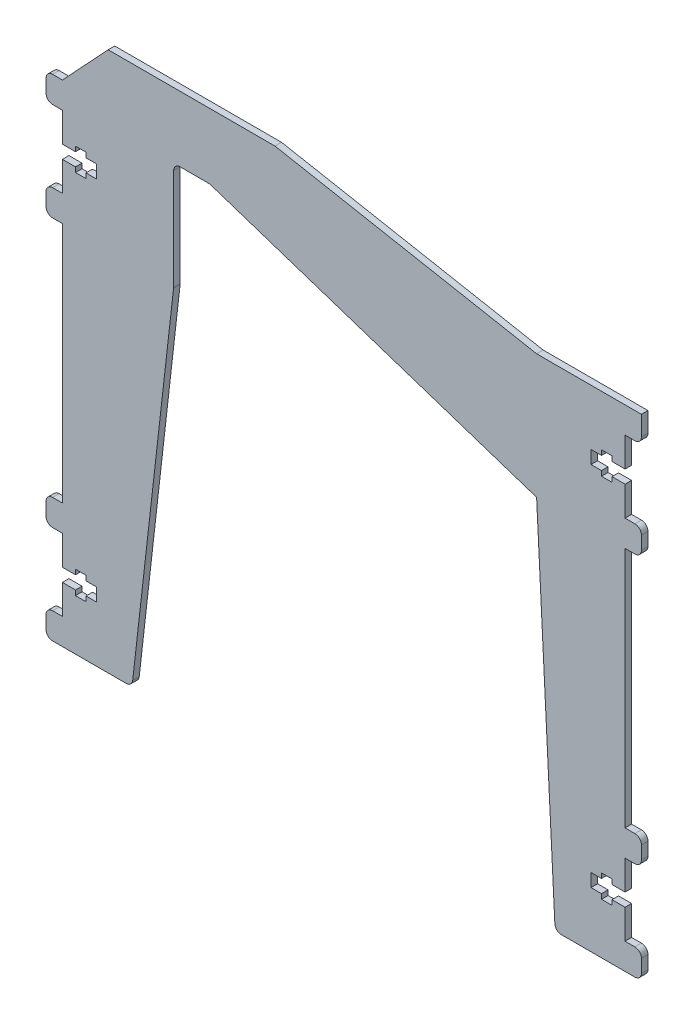
from build123d import *

# Parameters (mm, degrees)
EXTRUDE_1_DEPTH = 2
FILLET_1_R      = 2


with BuildPart() as part:
    # 草图1 → 凸台-拉伸1 (new body)
    with BuildSketch(Plane.XY):
        Polygon((81.606020908, 1.417469639), (81.606020908, 9.417469639), (76.606020908, 9.417469639), (76.606020908, 18.417469797), (72.606020908, 18.417469797), (72.606020908, 16.917469797), (69.406020908, 16.917469797), (69.406020908, 18.417469797), (66.206020908, 18.417469797), (66.206020908, 22.417469797), (69.406020908, 22.417469797), (69.406020908, 23.917469797), (72.606020908, 23.917469797), (72.606020908, 22.417469797), (76.606020908, 22.417469797), (76.606020908, 31.417469956), (81.606020908, 31.417469956), (81.606020908, 39.417469956), (76.606020908, 39.417469956), (49.568659109, 39.417469956), (-30.393979092, 54.417469639), (-81.393979092, 54.417469639), (-95.393979092, 39.417469956), (-100.393979092, 39.417469956), (-100.393979092, 31.417469956), (-95.393979092, 31.417469956), (-95.393979092, 22.417469797), (-91.393979092, 22.417469797), (-91.393979092, 23.917469797), (-88.193979092, 23.917469797), (-88.193979092, 22.417469797), (-84.993979092, 22.417469797), (-84.993979092, 18.417469797), (-88.193979092, 18.417469797), (-88.193979092, 16.917469797), (-91.393979092, 16.917469797), (-91.393979092, 18.417469797), (-95.393979092, 18.417469797), (-95.393979092, 9.417469639), (-100.393979092, 9.417469639), (-100.393979092, 1.417469639), (-95.393979092, 1.417469639), (-95.393979092, -72.582530044), (-100.393979092, -72.582530044), (-100.393979092, -80.582530044), (-95.393979092, -80.582530044), (-95.393979092, -89.582530203), (-91.393979092, -89.582530203), (-91.393979092, -88.082530203), (-88.193979092, -88.082530203), (-88.193979092, -89.582530203), (-84.993979092, -89.582530203), (-84.993979092, -93.582530203), (-88.193979092, -93.582530203), (-88.193979092, -95.082530203), (-91.393979092, -95.082530203), (-91.393979092, -93.582530203), (-95.393979092, -93.582530203), (-95.393979092, -102.582530361), (-100.393979092, -102.582530361), (-100.393979092, -110.582530361), (-95.393979092, -110.582530361), (-74.110124615, -110.582530361), (-61.393979092, 1.417469639), (-61.393979092, 34.417469639), (-50.393979092, 34.417469639), (49.568659109, 1.417469639), (55.241335591, -110.582530361), (76.606020908, -110.582530361), (81.606020908, -110.582530361), (81.606020908, -102.582530361), (76.606020908, -102.582530361), (76.606020908, -93.582530203), (72.606020908, -93.582530203), (72.606020908, -95.082530203), (69.406020908, -95.082530203), (69.406020908, -93.582530203), (66.206020908, -93.582530203), (66.206020908, -89.582530203), (69.406020908, -89.582530203), (69.406020908, -88.082530203), (72.606020908, -88.082530203), (72.606020908, -89.582530203), (76.606020908, -89.582530203), (76.606020908, -80.582530044), (81.606020908, -80.582530044), (81.606020908, -72.582530044), (76.606020908, -72.582530044), (76.606020908, 1.417469639), align=None)
    extrude(amount=EXTRUDE_1_DEPTH)

    # 圆角1
    fillet_1_edges = [part.edges().sort_by_distance(p)[0] for p in [
        (81.606020908, -102.582530361, 1),
        (81.606020908, -110.582530361, 1),
        (55.241335591, -110.582530361, 1),
        (-61.393979092, 34.417469639, 1),
        (-61.393979092, 1.417469639, 1),
        (-74.110124615, -110.582530361, 1),
        (-100.393979092, -110.582530361, 1),
        (-100.393979092, -102.582530361, 1),
        (-100.393979092, -80.582530044, 1),
        (-100.393979092, -72.582530044, 1),
        (-100.393979092, 1.417469639, 1),
        (-100.393979092, 9.417469639, 1),
        (-100.393979092, 31.417469956, 1),
        (-100.393979092, 39.417469956, 1),
        (81.606020908, 31.417469956, 1),
        (81.606020908, 9.417469639, 1),
        (81.606020908, 1.417469639, 1),
        (81.606020908, -72.582530044, 1),
        (81.606020908, -80.582530044, 1),
    ]]
    fillet(fillet_1_edges, radius=FILLET_1_R)


solid = part.part
